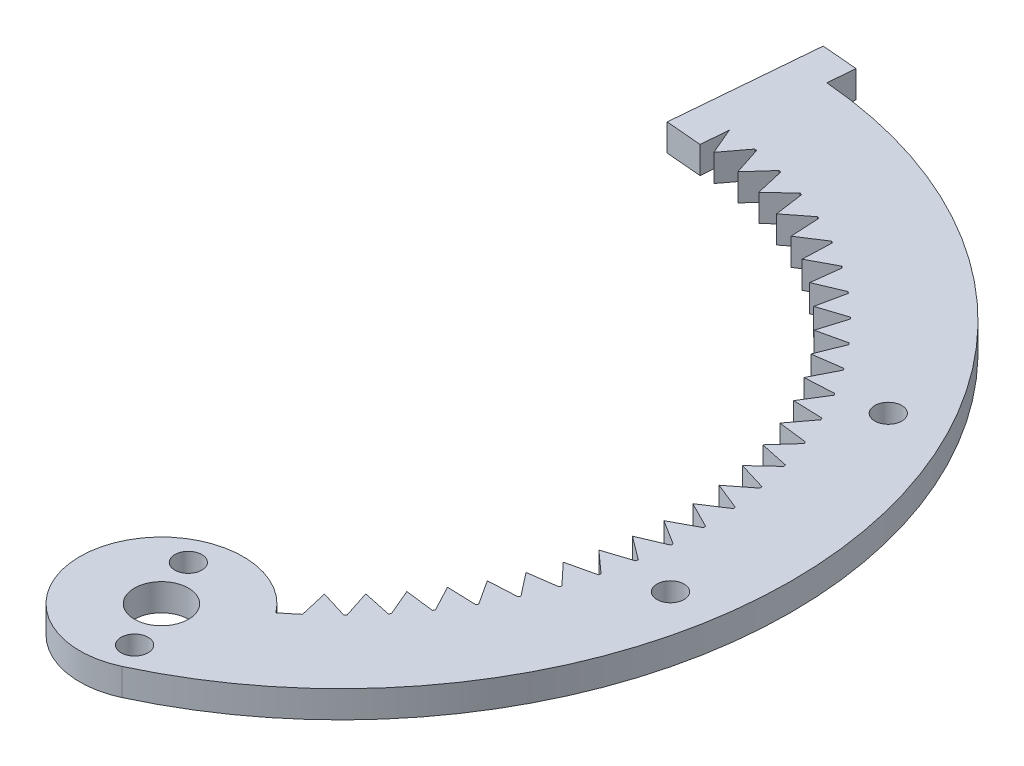
from build123d import *

# Parameters (mm, degrees)
SKETCH_1_R          = 3
EXTRUDE_1_DEPTH     = 3
SKETCH_2_R          = 1.5
CUT_EXTRUDE_1_DEPTH = 35
SKETCH_3_R          = 1.5
CUT_EXTRUDE_2_DEPTH = 10


with BuildPart() as part:
    # 草图1 → 凸台-拉伸1 (new body)
    with BuildSketch(Plane(origin=(0, 0, 0), x_dir=(1, 0, 0), z_dir=(0, 1, 0))):
        with BuildLine():
            Line((-14.251933165, 74.010414785), (-13.995374148, 76.999384294))
            Line((-13.995374148, 76.999384294), (-12.726300539, 74.013284805))
            Line((-12.726300539, 74.013284805), (-10.774799328, 76.605384534))
            ThreePointArc((-10.774799328, 76.605384534), (-10.653849778, 76.585389633), (-10.532962075, 76.565024143))
            Line((-10.532962075, 76.565024143), (-9.528973393, 73.479680611))
            Line((-9.528973393, 73.479680611), (-7.358981856, 75.891832081))
            ThreePointArc((-7.358981856, 75.891832081), (-7.240235225, 75.861371819), (-7.121582506, 75.830547768))
            Line((-7.121582506, 75.830547768), (-6.390319712, 72.669441521))
            Line((-6.390319712, 72.669441521), (-4.018352795, 74.883286801))
            ThreePointArc((-4.018352795, 74.883286801), (-3.902712818, 74.842592999), (-3.787198101, 74.801544977))
            Line((-3.787198101, 74.801544977), (-3.334226545, 71.588733941))
            Line((-3.334226545, 71.588733941), (-0.778336348, 73.587424334))
            ThreePointArc((-0.778336348, 73.587424334), (-0.666683115, 73.536806696), (-0.555185537, 73.485847103))
            Line((-0.555185537, 73.485847103), (-0.383952607, 70.245782711))
            Line((-0.383952607, 70.245782711), (2.336409001, 72.014106975))
            ThreePointArc((2.336409001, 72.014106975), (2.443225743, 71.953950731), (2.549857617, 71.893467401))
            Line((2.549857617, 71.893467401), (2.438048736, 68.650808499))
            Line((2.438048736, 68.650808499), (5.302178162, 70.175308618))
            ThreePointArc((5.302178162, 70.175308618), (5.403345471, 70.106071595), (5.504300109, 70.036524842))
            Line((5.504300109, 70.036524842), (5.110300349, 66.815950022))
            Line((5.110300349, 66.815950022), (8.096399838, 68.085023631))
            ThreePointArc((8.096399838, 68.085023631), (8.191147771, 68.007232764), (8.285656848, 67.929151881))
            Line((8.285656848, 67.929151881), (7.612464785, 64.755171662))
            Line((7.612464785, 64.755171662), (10.697808317, 65.759160344))
            ThreePointArc((10.697808317, 65.759160344), (10.785415785, 65.673407668), (10.872760029, 65.587386897))
            Line((10.872760029, 65.587386897), (9.925499062, 62.484157186))
            Line((9.925499062, 62.484157186), (13.086605309, 63.21541998))
            ThreePointArc((13.086605309, 63.21541998), (13.166405566, 63.122358125), (13.245920234, 63.029052137))
            Line((13.245920234, 63.029052137), (12.031799591, 60.020190385))
            Line((12.031799591, 60.020190385), (15.244610627, 60.473161941))
            ThreePointArc((15.244610627, 60.473161941), (15.315996344, 60.373499163), (15.387076283, 60.273618073))
            Line((15.387076283, 60.273618073), (13.915336154, 57.382023534))
            Line((13.915336154, 57.382023534), (17.155400546, 57.553256464))
            ThreePointArc((17.155400546, 57.553256464), (17.217828436, 57.447751259), (17.279932683, 57.342055221))
            Line((17.279932683, 57.342055221), (15.561773901, 54.589734677))
            Line((15.561773901, 54.589734677), (18.804432803, 54.477925795))
            ThreePointArc((18.804432803, 54.477925795), (18.857427751, 54.36738112), (18.910083656, 54.256674546))
            Line((18.910083656, 54.256674546), (16.958582445, 51.664574817))
            Line((16.958582445, 51.664574817), (20.179157265, 51.270575057))
            ThreePointArc((20.179157265, 51.270575057), (20.222315948, 51.155832223), (20.265122768, 51.040957657))
            Line((20.265122768, 51.040957657), (18.095131231, 48.628806187))
            Line((18.095131231, 48.628806187), (21.26911145, 47.955614125))
            ThreePointArc((21.26911145, 47.955614125), (21.302105404, 47.837546395), (21.334737353, 47.719378101))
            Line((21.334737353, 47.719378101), (18.962770436, 45.50553282))
            Line((18.962770436, 45.50553282), (22.066000147, 44.558271853))
            ThreePointArc((22.066000147, 44.558271853), (22.088578269, 44.437777794), (22.110786998, 44.317215104))
            Line((22.110786998, 44.317215104), (19.554896802, 42.318524712))
            Line((19.554896802, 42.318524712), (22.563758554, 41.104404068))
            ThreePointArc((22.563758554, 41.104404068), (22.57574901, 40.982400713), (22.587365497, 40.860361182))
            Line((22.587365497, 40.860361182), (19.867003889, 39.092036918))
            Line((19.867003889, 39.092036918), (22.758598428, 37.62029679))
            ThreePointArc((22.758598428, 37.62029679), (22.759909963, 37.497712656), (22.7608458, 37.375125079))
            Line((22.7608458, 37.375125079), (19.896716374, 35.85062496))
            Line((19.896716374, 35.85062496), (22.649036919, 34.132466177))
            ThreePointArc((22.649036919, 34.132466177), (22.639659553, 34.010234206), (22.629907617, 33.888031548))
            Line((22.629907617, 33.888031548), (19.643808128, 32.618957939))
            Line((19.643808128, 32.618957939), (22.235907857, 30.667456728))
            ThreePointArc((22.235907857, 30.667456728), (22.215912956, 30.546507177), (22.195547466, 30.425619474))
            Line((22.195547466, 30.425619474), (19.110203935, 29.421630793))
            Line((19.110203935, 29.421630793), (21.522355404, 27.251639255))
            ThreePointArc((21.522355404, 27.251639255), (21.491895142, 27.132892625), (21.461071091, 27.014239906))
            Line((21.461071091, 27.014239906), (18.299964844, 26.282977111))
            Line((18.299964844, 26.282977111), (20.513810124, 23.911010194))
            ThreePointArc((20.513810124, 23.911010194), (20.473116322, 23.795370217), (20.432068301, 23.6798555))
            Line((20.432068301, 23.6798555), (17.219257265, 23.226883944))
            Line((17.219257265, 23.226883944), (19.217947657, 20.670993748))
            ThreePointArc((19.217947657, 20.670993748), (19.167330019, 20.559340514), (19.116370426, 20.447842937))
            Line((19.116370426, 20.447842937), (15.876306034, 20.276610007))
            Line((15.876306034, 20.276610007), (17.644630298, 17.556248398))
            ThreePointArc((17.644630298, 17.556248398), (17.584474055, 17.449431657), (17.523990725, 17.342799782))
            Line((17.523990725, 17.342799782), (14.281331822, 17.454608664))
            Line((14.281331822, 17.454608664), (15.805831942, 14.590479238))
            ThreePointArc((15.805831942, 14.590479238), (15.736594919, 14.489311928), (15.667048166, 14.38835729))
            Line((15.667048166, 14.38835729), (12.446473346, 14.78235705))
            Line((12.446473346, 14.78235705), (13.715546954, 11.796257561))
            ThreePointArc((13.715546954, 11.796257561), (13.637756087, 11.701509628), (13.559675204, 11.607000551))
            Line((13.559675204, 11.607000551), (10.385694985, 12.280192614))
            Line((10.385694985, 12.280192614), (11.389683667, 9.194849082))
            ThreePointArc((11.389683667, 9.194849082), (11.303930991, 9.107241614), (11.217910221, 9.019897371))
            Line((11.217910221, 9.019897371), (8.114680509, 9.967158338))
            Line((8.114680509, 9.967158338), (8.845943303, 6.80605209))
            ThreePointArc((8.845943303, 6.80605209), (8.041013726, 6.131861333), (7.218665918, 5.479029897))
            ThreePointArc((7.218665918, 5.479029897), (-8.795258648, 2.184566676), (3.816136485, -8.219854535))
            ThreePointArc((3.816136485, -8.219854535), (31.986599548, 45.900244344), (-13.140159276, 86.962827432))
            Line((-13.140159276, 86.962827432), (-12.883600259, 89.951796941))
            Line((-12.883600259, 89.951796941), (-16.868945799, 90.293880168))
            Line((-16.868945799, 90.293880168), (-18.237278704, 74.352498011))
            Line((-18.237278704, 74.352498011), (-14.251933165, 74.010414785))
        make_face()
        with Locations(Location((0, 0, 0), (0, 0, 270))):
            Circle(SKETCH_1_R, mode=Mode.SUBTRACT)
    extrude(amount=EXTRUDE_1_DEPTH)

    # 草图2 → 切除-拉伸1 (cut)
    with BuildSketch(Plane(origin=(0, 3, 0), x_dir=(1, 0, 0), z_dir=(0, 1, 0))):
        with Locations(Location((-2.480429629, 5.463283706, 0), (0, 0, 270))):
            Circle(SKETCH_2_R)
        with Locations(Location((2.480429629, -5.463283706, 0), (0, 0, 270))):
            Circle(SKETCH_2_R)
    extrude(amount=-CUT_EXTRUDE_1_DEPTH, mode=Mode.SUBTRACT)

    # 草图3 → 切除-拉伸2 (cut)
    with BuildSketch(Plane(origin=(0, 3, 0), x_dir=(1, 0, 0), z_dir=(0, 1, 0))):
        with Locations(Location((27.095115734, 29.384103679, 0), (0, 0, 270))):
            Circle(SKETCH_3_R)
        with Locations(Location((22.024822818, 58.618310712, 0), (0, 0, 270))):
            Circle(SKETCH_3_R)
    extrude(amount=-CUT_EXTRUDE_2_DEPTH, mode=Mode.SUBTRACT)


solid = part.part
